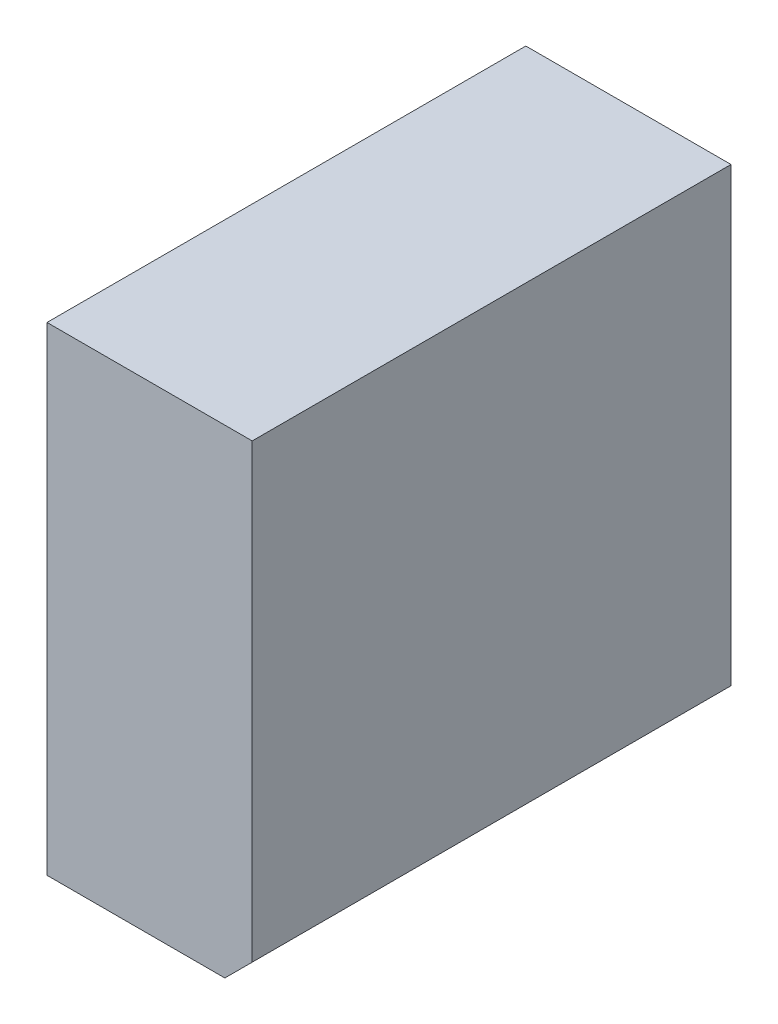
from build123d import *

# Parameters (mm, degrees)
SKETCH1_W           = 38.1
SKETCH1_H           = 88.9
BOSS_EXTRUDE1_DEPTH = 88.9
CHAMFER1_SIZE       = 5.08


with BuildPart() as part:
    # Sketch1 → Boss-Extrude1 (new body)
    with BuildSketch(Plane.XY):
        with Locations((19.05, 44.45)):
            Rectangle(SKETCH1_W, SKETCH1_H)
    extrude(amount=BOSS_EXTRUDE1_DEPTH)

    # Chamfer1
    chamfer1_edges = [part.edges().sort_by_distance(p)[0] for p in [
        (38.1, 0, 44.45),
    ]]
    chamfer(chamfer1_edges, length=CHAMFER1_SIZE)


solid = part.part
